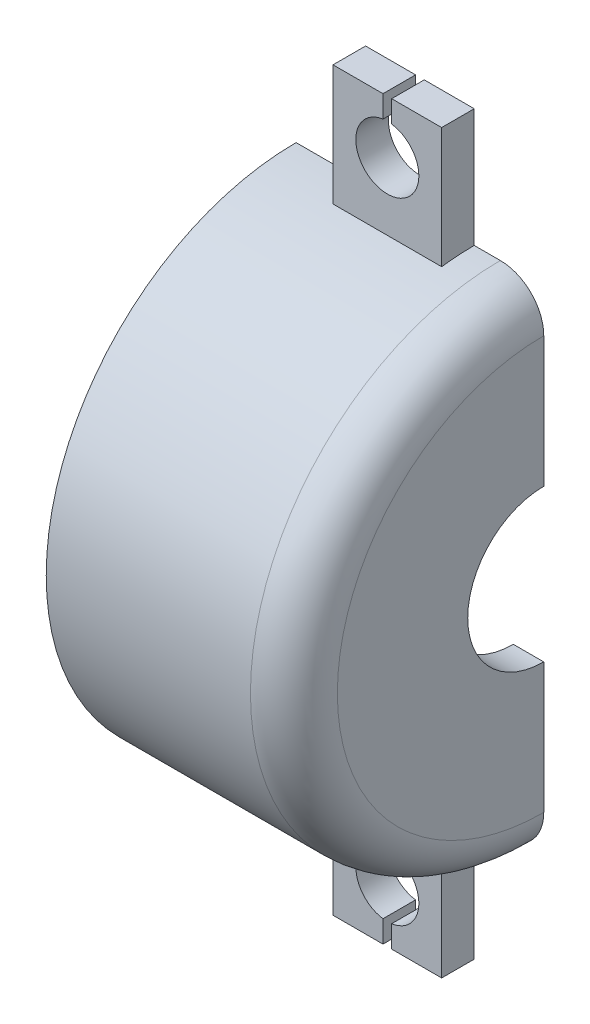
from build123d import *

# Parameters (mm, degrees)
SKETCH_3_W          = 14.74967026
SKETCH_3_H          = 24.956193141
CUT_EXTRUDE_2_DEPTH = 18
EXTRUDE_2_DEPTH     = 1.5
FILLET_1_R          = 2


with BuildPart() as part:
    # 草图1 → 旋转1 (revolve)
    with BuildSketch(Plane.XY, mode=Mode.PRIVATE) as revolve_1_sk:
        Polygon((-11.6, 6), (-11.6, 14), (-23, 14), (-23, 12), (-20, 13), (-20, 11), (-17, 11), (-17, 7.4), (-13, 7.4), (-13, 6), align=None)
    revolve(revolve_1_sk.sketch.rotate(Axis((-19.18351236, 2.5, 0), (1, 0, 0)), 180), axis=Axis((-19.18351236, 2.5, 0), (1, 0, 0)))

    # 草图3 → 切除-拉伸2 (cut)
    with BuildSketch(Plane.XY):
        with Locations((-16.988825522, 2.302922831)):
            Rectangle(SKETCH_3_W, SKETCH_3_H)
    extrude(amount=-CUT_EXTRUDE_2_DEPTH, mode=Mode.SUBTRACT)

    # 草图4 → 凸台-拉伸2 (add)
    with BuildSketch(Plane(origin=(0, 0, 0), x_dir=(-1, 0, 0), z_dir=(0, 0, -1))):
        with BuildLine():
            Line((14.8, 14), (14.8, 19.45))
            Line((14.8, 19.45), (17.1, 19.45))
            Line((17.1, 19.45), (17.1, 18.436140662))
            ThreePointArc((17.1, 18.436140662), (17.3, 15.55), (17.5, 18.436140662))
            Line((17.5, 18.436140662), (17.5, 19.45))
            Line((17.5, 19.45), (19.8, 19.45))
            Line((19.8, 19.45), (19.8, 14))
            Line((19.8, 14), (19.8, 12.669411603))
            Line((19.8, 12.669411603), (14.8, 12.669411603))
            Line((14.8, 12.669411603), (14.8, 14))
        make_face()
        with BuildLine():
            Line((19.8, -9), (19.8, -7.669411603))
            Line((19.8, -7.669411603), (14.8, -7.669411603))
            Line((14.8, -7.669411603), (14.8, -9))
            Line((14.8, -9), (14.8, -14.45))
            Line((14.8, -14.45), (17.1, -14.45))
            Line((17.1, -14.45), (17.1, -13.436140662))
            ThreePointArc((17.1, -13.436140662), (17.3, -10.55), (17.5, -13.436140662))
            Line((17.5, -13.436140662), (17.5, -14.45))
            Line((17.5, -14.45), (19.8, -14.45))
            Line((19.8, -14.45), (19.8, -9))
        make_face()
    extrude(amount=-EXTRUDE_2_DEPTH)

    # 圆角1
    fillet_1_edges = [part.edges().sort_by_distance(p)[0] for p in [
        (-11.6, 2.5, 11.5),
    ]]
    fillet(fillet_1_edges, radius=FILLET_1_R)


solid = part.part
